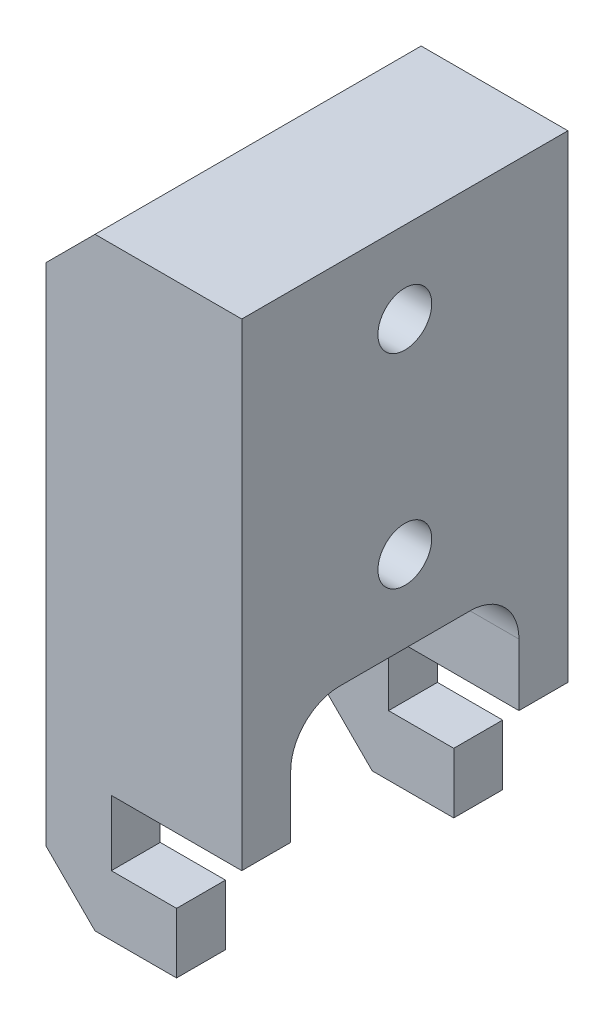
from build123d import *

# Parameters (mm, degrees)
SKETCH1_W                      = 20
SKETCH1_H                      = 37
BOSS_EXTRUDE1_DEPTH            = 12
SKETCH2_W                      = 12
SKETCH2_H                      = 14
CUT_EXTRUDE1_DEPTH             = 14.5
CHAMFER1_SIZE                  = 3
FILLET1_R                      = 3
SKETCH3_W                      = 3
SKETCH3_H                      = 7.7
CUT_EXTRUDE2_DEPTH             = 4.000000008
SKETCH4_W                      = 3
SKETCH4_H                      = 4
CUT_EXTRUDE3_DEPTH             = 4
F_3_3_3_3_DIAMETER_HOLE1_D     = 3.3
F_3_3_3_3_DIAMETER_HOLE1_DEPTH = 8
F_3_3_3_3_DIAMETER_HOLE1_TIP   = 0.991420021


with BuildPart() as part:
    # Sketch1 → Boss-Extrude1 (new body)
    with BuildSketch(Plane(origin=(0, 0, 0), x_dir=(0, 0, -1), z_dir=(1, 0, 0))):
        Rectangle(SKETCH1_W, SKETCH1_H)
    extrude(amount=BOSS_EXTRUDE1_DEPTH)

    # Sketch2 → Cut-Extrude1 (cut)
    with BuildSketch(Plane.XZ.offset(18.5)):
        with Locations((6, 0)):
            Rectangle(SKETCH2_W, SKETCH2_H)
    extrude(amount=-CUT_EXTRUDE1_DEPTH, mode=Mode.SUBTRACT)

    # Chamfer1
    chamfer1_edges = [part.edges().sort_by_distance(p)[0] for p in [
        (0, -18.5, -8.5),
        (0, 18.5, 0),
        (0, -18.5, 8.5),
    ]]
    chamfer(chamfer1_edges, length=CHAMFER1_SIZE)

    # Fillet1
    fillet1_edges = [part.edges().sort_by_distance(p)[0] for p in [
        (6, -4, -7),
        (6, -4, 7),
    ]]
    fillet(fillet1_edges, radius=FILLET1_R)

    # Sketch3 → Cut-Extrude2 (cut)
    with BuildSketch(Plane(origin=(12, 0, 0), x_dir=(0, 0, -1), z_dir=(1, 0, 0))):
        with Locations((-8.5, -14.65)):
            Rectangle(SKETCH3_W, SKETCH3_H)
        with Locations((8.5, -14.65)):
            Rectangle(SKETCH3_W, SKETCH3_H)
    extrude(amount=-CUT_EXTRUDE2_DEPTH, mode=Mode.SUBTRACT)

    # Sketch4 → Cut-Extrude3 (cut)
    with BuildSketch(Plane(origin=(7.999999992, 0, 0), x_dir=(0, 0, -1), z_dir=(1, 0, 0))):
        with Locations((-8.5, -12.8)):
            Rectangle(SKETCH4_W, SKETCH4_H)
        with Locations((8.5, -12.8)):
            Rectangle(SKETCH4_W, SKETCH4_H)
    extrude(amount=-CUT_EXTRUDE3_DEPTH, mode=Mode.SUBTRACT)

    # Ø3.3 (3.3) Diameter Hole1
    with Locations(Plane(origin=(12, 0, 0), x_dir=(0, 0, -1), z_dir=(1, 0, 0))):
        with Locations((0, 1), (0, 13.5)):
            Hole(F_3_3_3_3_DIAMETER_HOLE1_D / 2, depth=F_3_3_3_3_DIAMETER_HOLE1_DEPTH)
            with Locations((0, 0, -(F_3_3_3_3_DIAMETER_HOLE1_DEPTH + F_3_3_3_3_DIAMETER_HOLE1_TIP / 2))):  # 118° drill point
                Cone(0, F_3_3_3_3_DIAMETER_HOLE1_D / 2, F_3_3_3_3_DIAMETER_HOLE1_TIP, mode=Mode.SUBTRACT)


solid = part.part
